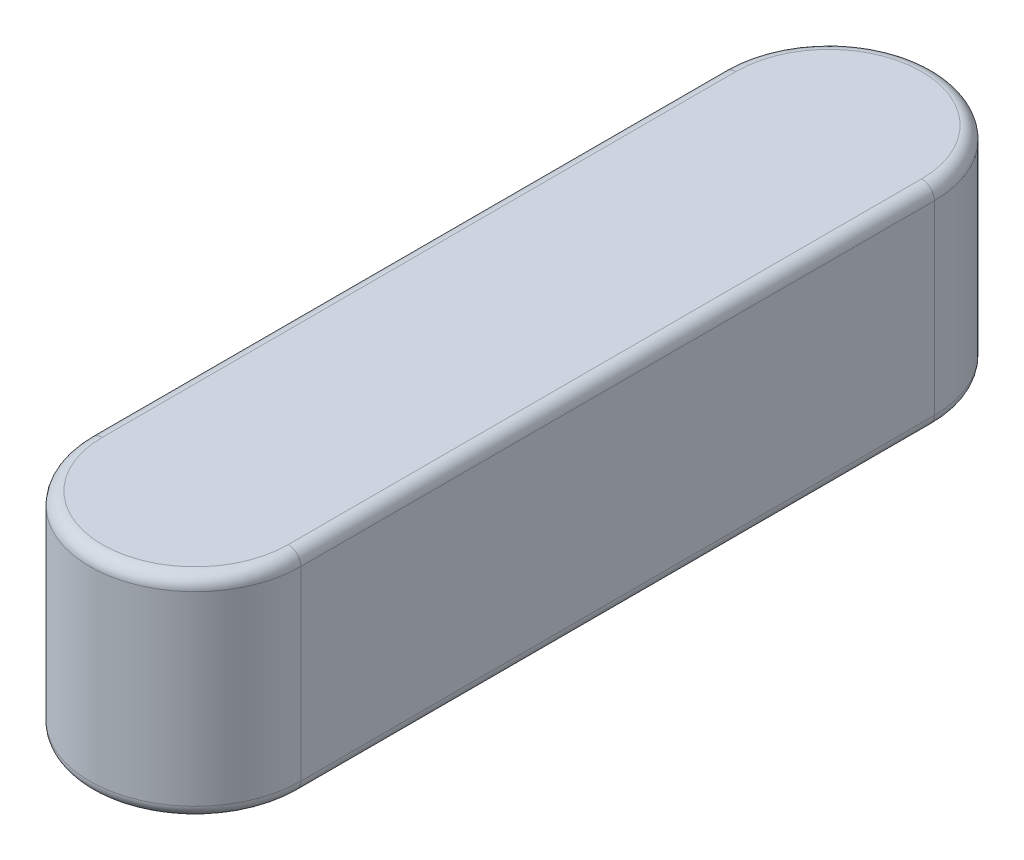
from build123d import *

# Parameters (mm, degrees)
SKETCH1_W           = 5
SKETCH1_H           = 5
BOSS_EXTRUDE1_DEPTH = 10
FILLET1_RADIUS      = 2.5
FILLET1_LENGTH      = 5
FILLET2_RADIUS      = 2.5
FILLET2_LENGTH      = 5
FILLET3_R           = 0.3


with BuildPart() as part:
    # Sketch1 → Boss-Extrude1 (new, symmetric)
    with BuildSketch(Plane.XY):
        Rectangle(SKETCH1_W, SKETCH1_H)
    extrude(amount=BOSS_EXTRUDE1_DEPTH, both=True)

    # Fillet1: full round fillet: the end face becomes a half cylinder, R = half its width
    fillet1_face = Plane((0, 0, 10), x_dir=(0, -1, 0), z_dir=(0, 0, 1))  # on the end face: x along it, z out of the body
    fillet1_slab = fillet1_face.offset(-FILLET1_RADIUS / 2) * Box(FILLET1_LENGTH, 2 * FILLET1_RADIUS, FILLET1_RADIUS, mode=Mode.PRIVATE)  # the body's end, R deep
    fillet1_round = Plane((0, 0, 7.5), x_dir=(0, 0, 1), z_dir=(0, -1, 0)) * Cylinder(FILLET1_RADIUS, FILLET1_LENGTH, mode=Mode.PRIVATE)  # its axis R under the face
    add(fillet1_slab - fillet1_round, mode=Mode.SUBTRACT)

    # Fillet2: full round fillet: the end face becomes a half cylinder, R = half its width
    fillet2_face = Plane((0, 0, -10), x_dir=(0, 1, 0), z_dir=(0, 0, -1))  # on the end face: x along it, z out of the body
    fillet2_slab = fillet2_face.offset(-FILLET2_RADIUS / 2) * Box(FILLET2_LENGTH, 2 * FILLET2_RADIUS, FILLET2_RADIUS, mode=Mode.PRIVATE)  # the body's end, R deep
    fillet2_round = Plane((0, 0, -7.5), x_dir=(0, 0, -1), z_dir=(0, 1, 0)) * Cylinder(FILLET2_RADIUS, FILLET2_LENGTH, mode=Mode.PRIVATE)  # its axis R under the face
    add(fillet2_slab - fillet2_round, mode=Mode.SUBTRACT)

    # Fillet3
    fillet3_edges = [part.edges().sort_by_distance(p)[0] for p in [
        (2.5, 2.5, 0),
        (2.5, -2.5, 0),
        (-2.5, -2.5, 0),
        (-2.5, 2.5, 0),
        (0, 2.5, 10),
        (0, -2.5, 10),
        (0, -2.5, -10),
        (0, 2.5, -10),
    ]]
    fillet(fillet3_edges, radius=FILLET3_R)


solid = part.part
